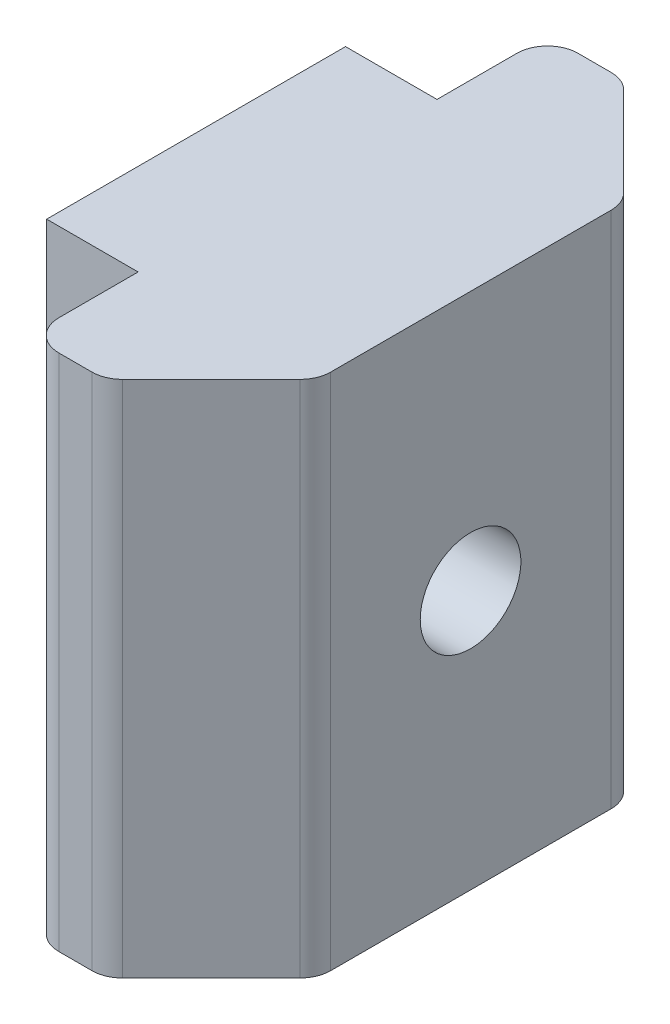
from build123d import *

# Parameters (mm, degrees)
BOSS_EXTRUDE1_DEPTH = 17
M4_TAPPED_HOLE1_D   = 3.3


with BuildPart() as part:
    # Sketch1 → Boss-Extrude1 (new body)
    with BuildSketch(Plane(origin=(0, 0, 0), x_dir=(1, 0, 0), z_dir=(0, 1, 0))):
        with BuildLine():
            Line((10.214282758, -18.266545266), (13.128495977, -15.352332485))
            ThreePointArc((13.128495977, -15.352332485), (13.345268844, -15.027908548), (13.421388977, -14.645224485))
            Line((13.421388977, -14.645224485), (13.421388977, -5.451641485))
            ThreePointArc((13.421388977, -5.451641485), (13.345268461, -5.068958498), (13.128495977, -4.744535485))
            Line((13.128495977, -4.744535485), (10.214282758, -1.830320704))
            ThreePointArc((10.214282758, -1.830320704), (9.889859409, -1.613547953), (9.507175977, -1.537427485))
            Line((9.507175977, -1.537427485), (8.421388977, -1.537427485))
            ThreePointArc((8.421388977, -1.537427485), (7.714282177, -1.830320722), (7.421388977, -2.537427537))
            Line((7.421388977, -2.537427537), (7.421388977, -5.159438485))
            Line((7.421388977, -5.159438485), (4.421388977, -5.159438485))
            Line((4.421388977, -5.159438485), (4.421388977, -14.959438485))
            Line((4.421388977, -14.959438485), (7.421388977, -14.959438485))
            Line((7.421388977, -14.959438485), (7.421388977, -17.559438537))
            ThreePointArc((7.421388977, -17.559438537), (7.714282276, -18.266545347), (8.421389151, -18.559438485))
            Line((8.421389151, -18.559438485), (9.507176151, -18.559438485))
            ThreePointArc((9.507176151, -18.559438485), (9.88985949, -18.483317984), (10.214282758, -18.266545266))
        make_face()
    extrude(amount=BOSS_EXTRUDE1_DEPTH)

    # M4 Tapped Hole1 (through all)
    with Locations(Plane.ZY.offset(-4.421388977)):
        with Locations((10.059438485, 8.5)):
            Hole(M4_TAPPED_HOLE1_D / 2)


solid = part.part
